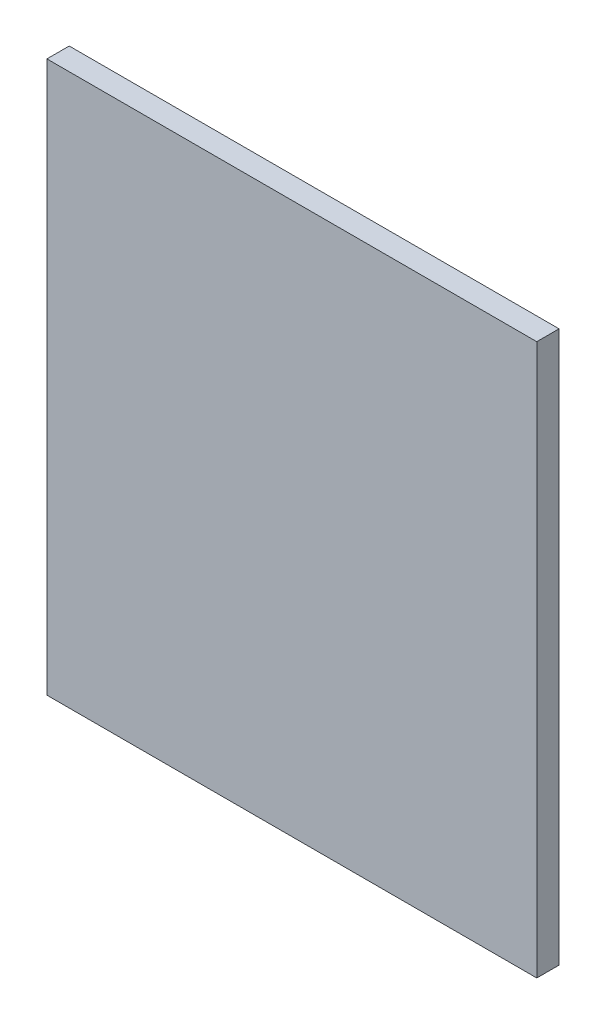
from build123d import *

# Parameters (mm, degrees)
SKETCH_1_W      = 31.2
SKETCH_1_H      = 35.1
EXTRUDE_1_DEPTH = 1.42


with BuildPart() as part:
    # 草图1 → 凸台-拉伸1 (new body)
    with BuildSketch(Plane.XY):
        with Locations((0.460759494, -5.767721519)):
            Rectangle(SKETCH_1_W, SKETCH_1_H)
    extrude(amount=EXTRUDE_1_DEPTH)


solid = part.part
